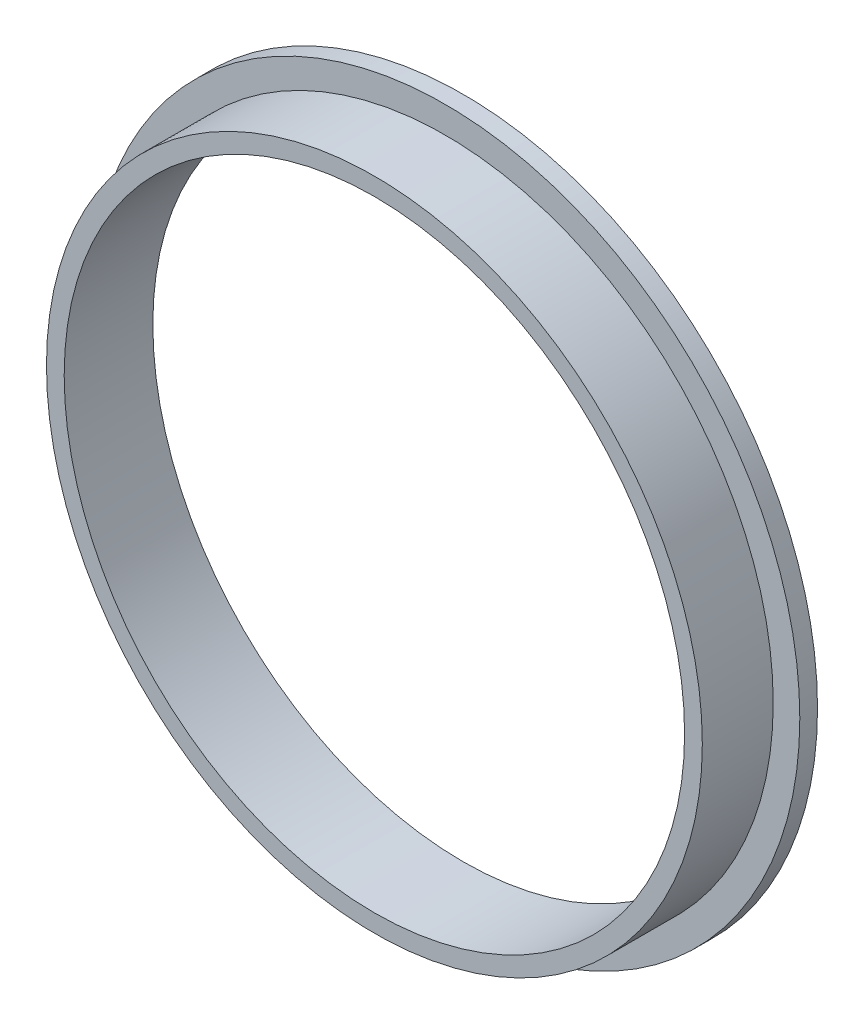
from build123d import *

# Parameters (mm, degrees)
ESQUISSE1_R             = 37
ESQUISSE1_R_2           = 35
BOSS_EXTRU_1_DEPTH      = 10
ESQUISSE3_R             = 40
BOSS_EXTRU_2_DEPTH      = 2
ENL_V_START             = -2
ESQUISSE4_R             = 35
ENL_V_MAT_EXTRU_1_DEPTH = 2


with BuildPart() as part:
    # Esquisse1 → Boss.-Extru.1 (new body)
    with BuildSketch(Plane.XY):
        Circle(ESQUISSE1_R)
        Circle(ESQUISSE1_R_2, mode=Mode.SUBTRACT)
    extrude(amount=BOSS_EXTRU_1_DEPTH)

    # Esquisse3 → Boss.-Extru.2 (add)
    with BuildSketch(Plane.XY):
        Circle(ESQUISSE3_R)
    extrude(amount=BOSS_EXTRU_2_DEPTH)

    # Esquisse4 → Enlèv. mat.-Extru.1 (cut)
    with BuildSketch(Plane.XY.offset(2).offset(ENL_V_START)):
        Circle(ESQUISSE4_R)
    extrude(amount=ENL_V_MAT_EXTRU_1_DEPTH, mode=Mode.SUBTRACT)


solid = part.part
